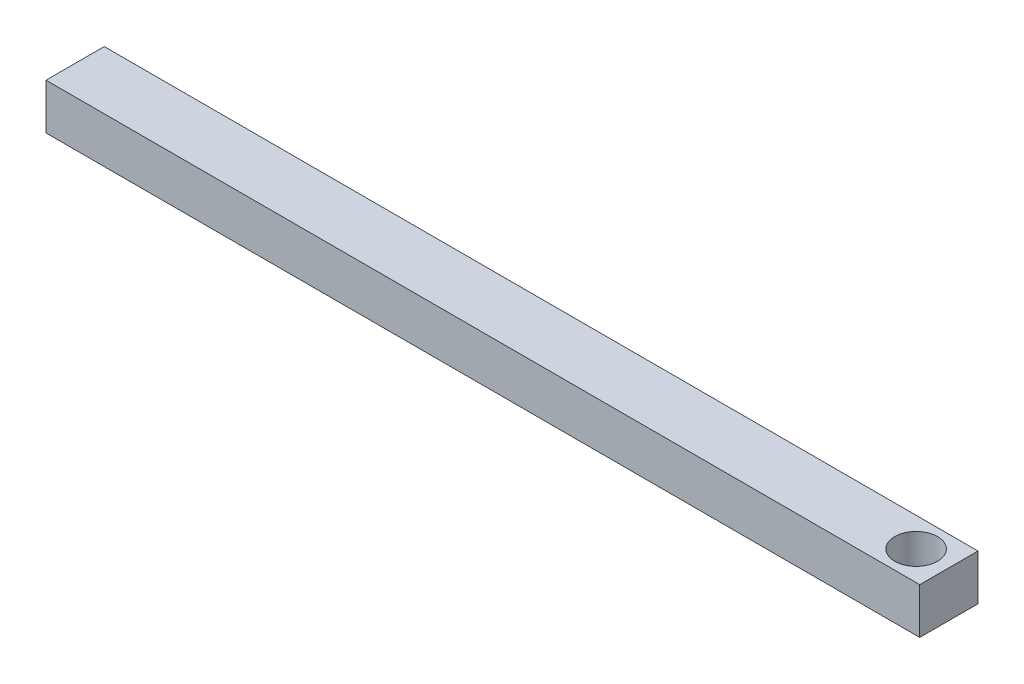
from build123d import *

# Parameters (mm, degrees)
SKETCH1_W           = 60
SKETCH1_H           = 4
SKETCH1_R           = 1.47
BOSS_EXTRUDE1_DEPTH = 3.14


with BuildPart() as part:
    # Sketch1 → Boss-Extrude1 (new body)
    with BuildSketch(Plane(origin=(0, 0, 0), x_dir=(1, 0, 0), z_dir=(0, 1, 0))):
        Rectangle(SKETCH1_W, SKETCH1_H)
        with Locations(Location((27.75, 0, 0), (0, 0, 270))):
            Circle(SKETCH1_R, mode=Mode.SUBTRACT)
    extrude(amount=BOSS_EXTRUDE1_DEPTH)


solid = part.part
